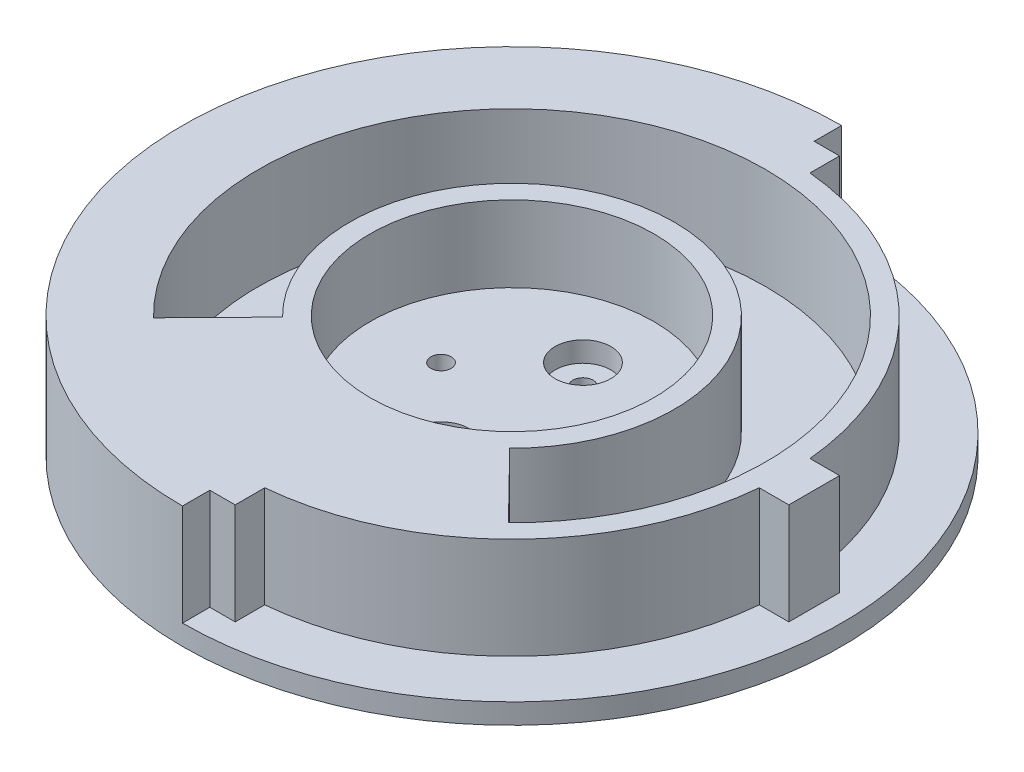
from build123d import *

# Parameters (mm, degrees)
SKETCH1_R               = 27
SKETCH1_R_2             = 14
BOSS_EXTRUDE1_DEPTH     = 10
SKETCH2_R               = 32.5
BOSS_EXTRUDE2_DEPTH     = 2
SKETCH3_W               = 5
SKETCH3_H               = 4.39677325
SKETCH3_W_2             = 4.39677325
SKETCH3_H_2             = 5
BOSS_EXTRUDE3_DEPTH     = 10
BOSS_EXTRUDE4_DEPTH     = 10
BOSS_EXTRUDE5_START     = -2.5
SKETCH6_R               = 14
BOSS_EXTRUDE5_DEPTH     = 2.5
CUT_EXTRUDE1_DEPTH      = 48.502631506
CUT_EXTRUDE1_DEPTH_BACK = 48.502631506
SKETCH4_R               = 1
SKETCH10_R              = 2.75
CUT_EXTRUDE4_DEPTH      = 2
SKETCH11_R              = 4.25
CUT_EXTRUDE5_DEPTH      = 1


with BuildPart() as part:
    # Sketch1 → Boss-Extrude1 (new body)
    with BuildSketch(Plane(origin=(0, 0, 0), x_dir=(1, 0, 0), z_dir=(0, 1, 0))):
        with Locations(Location((0, 0, 0), (0, 0, 270))):
            Circle(SKETCH1_R)
        with Locations(Location((0, 0, 0), (0, 0, 270))):
            Circle(SKETCH1_R_2, mode=Mode.SUBTRACT)
        with BuildLine():
            Line((-17.5, -17.853571071), (-11.2, -11.426285486))
            ThreePointArc((-11.2, -11.426285486), (0, 16), (11.2, -11.426285486))
            Line((11.2, -11.426285486), (17.5, -17.853571071))
            ThreePointArc((17.5, -17.853571071), (0, 25), (-17.5, -17.853571071))
        make_face(mode=Mode.SUBTRACT)
    extrude(amount=BOSS_EXTRUDE1_DEPTH)

    # Sketch2 → Boss-Extrude2 (add)
    with BuildSketch(Plane.XZ):
        with Locations(Location((0, 0, 0), (0, 0, 270))):
            Circle(SKETCH2_R)
    extrude(amount=BOSS_EXTRUDE2_DEPTH)

    # Sketch3 → Boss-Extrude3 (add)
    with BuildSketch(Plane(origin=(0, 0, 0), x_dir=(1, 0, 0), z_dir=(0, 1, 0))):
        with Locations((0, 27.601613375)):
            Rectangle(SKETCH3_W, SKETCH3_H)
        with Locations((27.601613375, 0)):
            Rectangle(SKETCH3_W_2, SKETCH3_H_2)
        with Locations((0, -27.601613375)):
            Rectangle(SKETCH3_W, SKETCH3_H)
        with Locations((-27.601613375, 0)):
            Rectangle(SKETCH3_W_2, SKETCH3_H_2)
    extrude(amount=BOSS_EXTRUDE3_DEPTH)

    # Sketch5 → Boss-Extrude4 (add)
    with BuildSketch(Plane(origin=(0, 0, 0), x_dir=(1, 0, 0), z_dir=(0, 1, 0))):
        with BuildLine():
            Line((0, 29.8), (0, 32.5))
            ThreePointArc((0, 32.5), (-32.5, 0), (0, -32.5))
            Line((0, -32.5), (0, -29.8))
            Line((0, -29.8), (-2.5, -29.8))
            Line((-2.5, -29.8), (-2.5, -26.884010118))
            ThreePointArc((-2.5, -26.884010118), (-19.091883092, -19.091883092), (-26.884010118, -2.5))
            Line((-26.884010118, -2.5), (-29.8, -2.5))
            Line((-29.8, -2.5), (-29.8, 2.5))
            Line((-29.8, 2.5), (-26.884010118, 2.5))
            ThreePointArc((-26.884010118, 2.5), (-19.091883092, 19.091883092), (-2.5, 26.884010118))
            Line((-2.5, 26.884010118), (-2.5, 29.8))
            Line((-2.5, 29.8), (0, 29.8))
        make_face()
    extrude(amount=BOSS_EXTRUDE4_DEPTH)

    # Sketch6 → Boss-Extrude5 (add)
    with BuildSketch(Plane(origin=(0, 2.5, 0), x_dir=(1, 0, 0), z_dir=(0, 1, 0)).offset(BOSS_EXTRUDE5_START)):
        with Locations(Location((0, 0, 0), (0, 0, 270))):
            Circle(SKETCH6_R)
    extrude(amount=BOSS_EXTRUDE5_DEPTH)

    # Sketch4 → Cut-Extrude1 (cut, two sides: drawn at the far end of the back side and taken through both)
    with BuildSketch(Plane.XZ.offset(2).offset(-CUT_EXTRUDE1_DEPTH_BACK)):
        with Locations(Location((0, -7, 0), (0, 0, 270))):
            Circle(SKETCH4_R)
        with Locations(Location((-7, 0, 0), (0, 0, 270))):
            Circle(SKETCH4_R)
        with Locations(Location((0, 7, 0), (0, 0, 270))):
            Circle(SKETCH4_R)
        with Locations(Location((7, 0, 0), (0, 0, 270))):
            Circle(SKETCH4_R)
    extrude(amount=CUT_EXTRUDE1_DEPTH + CUT_EXTRUDE1_DEPTH_BACK, mode=Mode.SUBTRACT)

    # Sketch10 → Cut-Extrude4 (cut)
    with BuildSketch(Plane(origin=(0, 2.5, 0), x_dir=(1, 0, 0), z_dir=(0, 1, 0))):
        with Locations(Location((0, 7, 0), (0, 0, 270))):
            Circle(SKETCH10_R)
        with Locations(Location((0, -7, 0), (0, 0, 270))):
            Circle(SKETCH10_R)
    extrude(amount=-CUT_EXTRUDE4_DEPTH, mode=Mode.SUBTRACT)

    # Sketch11 → Cut-Extrude5 (cut)
    with BuildSketch(Plane.XZ.offset(2)):
        with Locations(Location((0, 0, 0), (0, 0, 270))):
            Circle(SKETCH11_R)
    extrude(amount=-CUT_EXTRUDE5_DEPTH, mode=Mode.SUBTRACT)


solid = part.part
